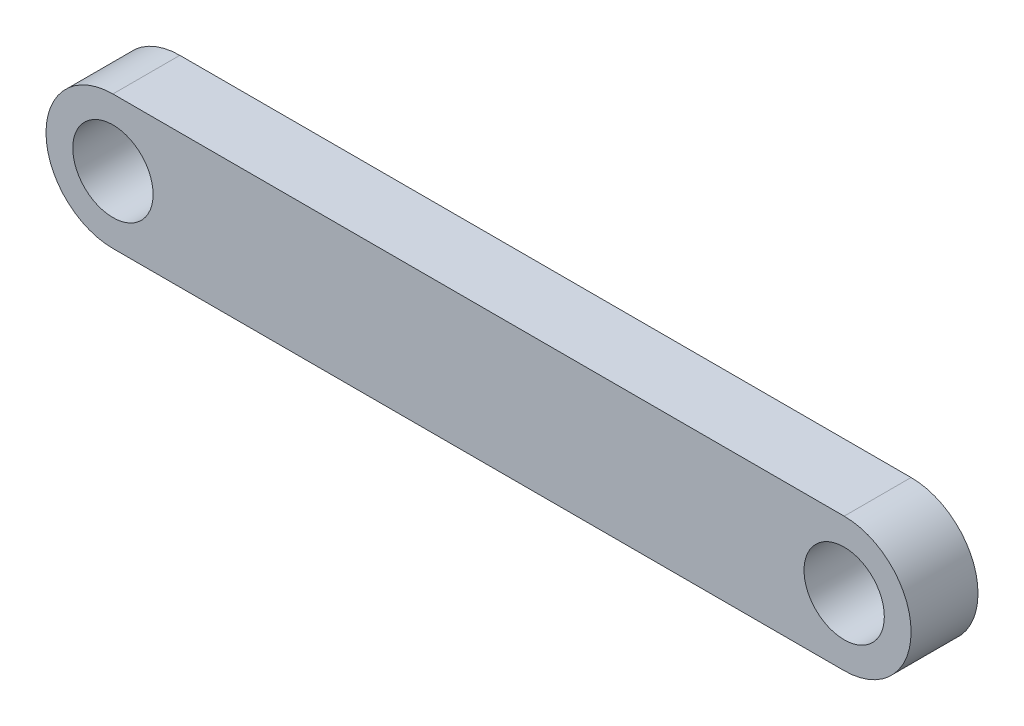
from build123d import *

# Parameters (mm, degrees)
ESBO_O1_R                = 3
RESSALTO_EXTRUS_O1_DEPTH = 5


with BuildPart() as part:
    # Esboço1 → Ressalto-extrusão1 (new body)
    with BuildSketch(Plane.XY):
        with BuildLine():
            Line((-27.3185, 5), (27.3185, 5))
            ThreePointArc((27.3185, 5), (32.3185, 0), (27.3185, -5))
            Line((27.3185, -5), (-27.3185, -5))
            ThreePointArc((-27.3185, -5), (-32.3185, 0), (-27.3185, 5))
        make_face()
        with Locations((-27.3185, 0)):
            Circle(ESBO_O1_R, mode=Mode.SUBTRACT)
        with Locations((27.3185, 0)):
            Circle(ESBO_O1_R, mode=Mode.SUBTRACT)
    extrude(amount=RESSALTO_EXTRUS_O1_DEPTH)


solid = part.part
